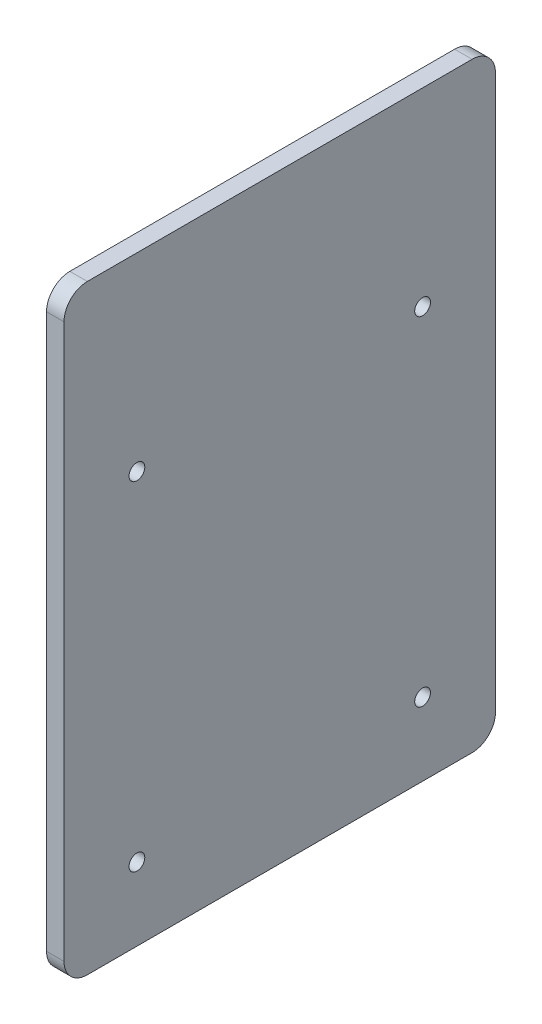
from build123d import *

# Parameters (mm, degrees)
SKETCH1_W           = 103
SKETCH1_H           = 74
BOSS_EXTRUDE2_DEPTH = 3
SKETCH1_12_R        = 1.35
CUT_EXTRUDE1_DEPTH  = 3
FILLET1_R           = 4


with BuildPart() as part:
    # Sketch1 → Boss-Extrude2 (new body)
    with BuildSketch(Plane.YZ):
        with Locations((10, 0)):
            Rectangle(SKETCH1_W, SKETCH1_H)
    extrude(amount=-BOSS_EXTRUDE2_DEPTH)

    # Sketch1<12> → Cut-Extrude1 (cut)
    with BuildSketch(Plane.YZ):
        with Locations((29, -24.5)):
            Circle(SKETCH1_12_R)
        with Locations((-29, -24.5)):
            Circle(SKETCH1_12_R)
        with Locations((-29, 24.5)):
            Circle(SKETCH1_12_R)
        with Locations((29, 24.5)):
            Circle(SKETCH1_12_R)
    extrude(amount=-CUT_EXTRUDE1_DEPTH, mode=Mode.SUBTRACT)

    # Fillet1
    fillet1_edges = [part.edges().sort_by_distance(p)[0] for p in [
        (-1.5, -41.5, 37),
        (-1.5, 61.5, 37),
        (-1.5, 61.5, -37),
        (-1.5, -41.5, -37),
    ]]
    fillet(fillet1_edges, radius=FILLET1_R)


solid = part.part
